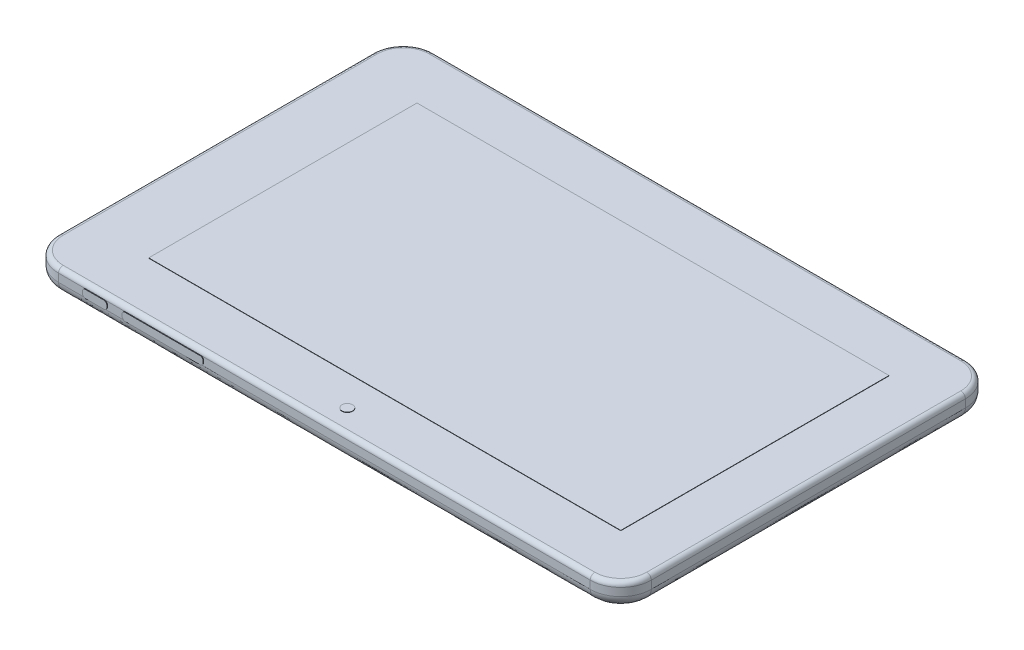
from build123d import *

# Parameters (mm, degrees)
DODANIE_WYCI_GNI_CIE1_DEPTH = 10.1
DODANIE_WYCI_GNI_CIE2_DEPTH = 0.2
DODANIE_WYCI_GNI_CIE3_DEPTH = 0.2
WYTNIJ_WYCI_GNI_CIE1_DEPTH  = 5
SZKIC10_W                   = 154.5
SZKIC10_H                   = 87.8
DODANIE_WYCI_GNI_CIE4_DEPTH = 0.1
SZKIC9_R                    = 1.75
DODANIE_WYCI_GNI_CIE5_DEPTH = 0.1


with BuildPart() as part:
    # Szkic1 → Dodanie-wyciągnięcie1 (new body)
    with BuildSketch(Plane(origin=(0, 0, 0), x_dir=(1, 0, 0), z_dir=(0, 1, 0))):
        with BuildLine():
            Line((-45.648009954, -1126.322861225), (-45.648009954, -1229.122861225))
            ThreePointArc((-45.648009954, -1229.122861225), (-42.719077766, -1236.193929037), (-35.648009954, -1239.122861225))
            Line((-35.648009954, -1239.122861225), (138.351990046, -1239.122861225))
            ThreePointArc((138.351990046, -1239.122861225), (145.423057858, -1236.193929037), (148.351990046, -1229.122861225))
            Line((148.351990046, -1229.122861225), (148.351990046, -1126.322861225))
            ThreePointArc((148.351990046, -1126.322861225), (145.423057858, -1119.251793413), (138.351990046, -1116.322861225))
            Line((138.351990046, -1116.322861225), (-35.648009954, -1116.322861225))
            ThreePointArc((-35.648009954, -1116.322861225), (-42.719077766, -1119.251793413), (-45.648009954, -1126.322861225))
        make_face()
    extrude(amount=DODANIE_WYCI_GNI_CIE1_DEPTH)

    # Wycięcie-wyciągnięcie po ścieżce1: sweep along a path in Szkic3
    with BuildLine(Plane(origin=(0, 10.1, 0), x_dir=(1, 0, 0), z_dir=(0, 1, 0))) as wyci_cie_wyci_gni_cie_po_cie_ce1_path:
        Line((138.351990046, -1116.322861225), (-35.648009954, -1116.322861225))
        ThreePointArc((-35.648009954, -1116.322861225), (-42.719077766, -1119.251793413), (-45.648009954, -1126.322861225))
        Line((-45.648009954, -1126.322861225), (-45.648009954, -1229.122861225))
        ThreePointArc((-45.648009954, -1229.122861225), (-42.719077766, -1236.193929037), (-35.648009954, -1239.122861225))
        Line((-35.648009954, -1239.122861225), (138.351990046, -1239.122861225))
        ThreePointArc((138.351990046, -1239.122861225), (145.423057858, -1236.193929037), (148.351990046, -1229.122861225))
        Line((148.351990046, -1229.122861225), (148.351990046, -1126.322861225))
        ThreePointArc((148.351990046, -1126.322861225), (145.423057858, -1119.251793413), (138.351990046, -1116.322861225))
    # Szkic2 → Wycięcie-wyciągnięcie po ścieżce1 (sweep, cut)
    with BuildSketch(Plane.ZY.offset(35.648009954)):
        with BuildLine():
            Line((1116.322861225, 10.1), (1116.322861225, 8.6))
            ThreePointArc((1116.322861225, 8.6), (1116.762201053, 9.660660172), (1117.822861225, 10.1))
            Line((1117.822861225, 10.1), (1116.322861225, 10.1))
        make_face()
    sweep(path=wyci_cie_wyci_gni_cie_po_cie_ce1_path.line, mode=Mode.SUBTRACT)

    # Wycięcie-wyciągnięcie po ścieżce2: sweep along a path in Szkic4
    with BuildLine(Plane.XZ) as wyci_cie_wyci_gni_cie_po_cie_ce2_path:
        Line((138.351990046, 1239.122861225), (-35.648009954, 1239.122861225))
        ThreePointArc((-35.648009954, 1239.122861225), (-42.719077766, 1236.193929037), (-45.648009954, 1229.122861225))
        Line((-45.648009954, 1229.122861225), (-45.648009954, 1126.322861225))
        ThreePointArc((-45.648009954, 1126.322861225), (-42.719077766, 1119.251793413), (-35.648009954, 1116.322861225))
        Line((-35.648009954, 1116.322861225), (138.351990046, 1116.322861225))
        ThreePointArc((138.351990046, 1116.322861225), (145.423057858, 1119.251793413), (148.351990046, 1126.322861225))
        Line((148.351990046, 1126.322861225), (148.351990046, 1229.122861225))
        ThreePointArc((148.351990046, 1229.122861225), (145.423057858, 1236.193929037), (138.351990046, 1239.122861225))
    # Szkic5 → Wycięcie-wyciągnięcie po ścieżce2 (sweep, cut)
    with BuildSketch(Plane.ZY.offset(35.648009954)):
        with BuildLine():
            Line((1116.322861225, 0), (1116.322861225, 6))
            add(Edge.make_bspline(
                [(1116.322861225, 6), (1116.448621512, 1.561373174), (1126.322861225, 0)],
                knots=[0, 0, 0, 1, 1, 1], degree=2))
            Line((1126.322861225, 0), (1116.322861225, 0))
        make_face()
    sweep(path=wyci_cie_wyci_gni_cie_po_cie_ce2_path.line, mode=Mode.SUBTRACT)

    # Szkic6 → Dodanie-wyciągnięcie2 (add)
    with BuildSketch(Plane.XY.offset(1239.122861225)):
        with BuildLine():
            Line((-26.648009954, 8.6), (-20.648009954, 8.6))
            ThreePointArc((-20.648009954, 8.6), (-19.940903173, 8.307106781), (-19.648009954, 7.6))
            Line((-19.648009954, 7.6), (-19.648009954, 7))
            ThreePointArc((-19.648009954, 7), (-19.940903173, 6.292893219), (-20.648009954, 6))
            Line((-20.648009954, 6), (-26.648009954, 6))
            ThreePointArc((-26.648009954, 6), (-27.355116735, 6.292893219), (-27.648009954, 7))
            Line((-27.648009954, 7), (-27.648009954, 7.6))
            ThreePointArc((-27.648009954, 7.6), (-27.355116735, 8.307106781), (-26.648009954, 8.6))
        make_face()
    extrude(amount=DODANIE_WYCI_GNI_CIE2_DEPTH)

    # Szkic7 → Dodanie-wyciągnięcie3 (add)
    with BuildSketch(Plane.XY.offset(1239.122861225)):
        with BuildLine():
            Line((-13.648009954, 8.6), (10.851990046, 8.6))
            ThreePointArc((10.851990046, 8.6), (11.559096827, 8.307106781), (11.851990046, 7.6))
            Line((11.851990046, 7.6), (11.851990046, 7))
            ThreePointArc((11.851990046, 7), (11.559096827, 6.292893219), (10.851990046, 6))
            Line((10.851990046, 6), (-13.648009954, 6))
            ThreePointArc((-13.648009954, 6), (-14.355116735, 6.292893219), (-14.648009954, 7))
            Line((-14.648009954, 7), (-14.648009954, 7.6))
            ThreePointArc((-14.648009954, 7.6), (-14.355116735, 8.307106781), (-13.648009954, 8.6))
        make_face()
    extrude(amount=DODANIE_WYCI_GNI_CIE3_DEPTH)

    # Szkic8 → Wytnij-wyciągnięcie1 (cut)
    with BuildSketch(Plane.ZY.offset(45.648009954)):
        with BuildLine():
            Line((1151.122861225, 8.6), (1157.122861225, 8.6))
            ThreePointArc((1157.122861225, 8.6), (1157.829968006, 8.307106781), (1158.122861225, 7.6))
            Line((1158.122861225, 7.6), (1158.122861225, 7))
            ThreePointArc((1158.122861225, 7), (1157.829968006, 6.292893219), (1157.122861225, 6))
            Line((1157.122861225, 6), (1151.122861225, 6))
            ThreePointArc((1151.122861225, 6), (1150.415754444, 6.292893219), (1150.122861225, 7))
            Line((1150.122861225, 7), (1150.122861225, 7.6))
            ThreePointArc((1150.122861225, 7.6), (1150.415754444, 8.307106781), (1151.122861225, 8.6))
        make_face()
    extrude(amount=-WYTNIJ_WYCI_GNI_CIE1_DEPTH, mode=Mode.SUBTRACT)

    # Szkic10 → Dodanie-wyciągnięcie4 (add)
    with BuildSketch(Plane(origin=(0, 10.1, 0), x_dir=(1, 0, 0), z_dir=(0, 1, 0))):
        with Locations((53.601990046, -1177.722861225)):
            Rectangle(SZKIC10_W, SZKIC10_H)
    extrude(amount=DODANIE_WYCI_GNI_CIE4_DEPTH)

    # Szkic9 → Dodanie-wyciągnięcie5 (add)
    with BuildSketch(Plane(origin=(0, 10.1, 0), x_dir=(1, 0, 0), z_dir=(0, 1, 0))):
        with Locations(Location((51.351990046, -1231.622861225, 0), (0, 0, 270))):
            Circle(SZKIC9_R)
    extrude(amount=DODANIE_WYCI_GNI_CIE5_DEPTH)


solid = part.part
